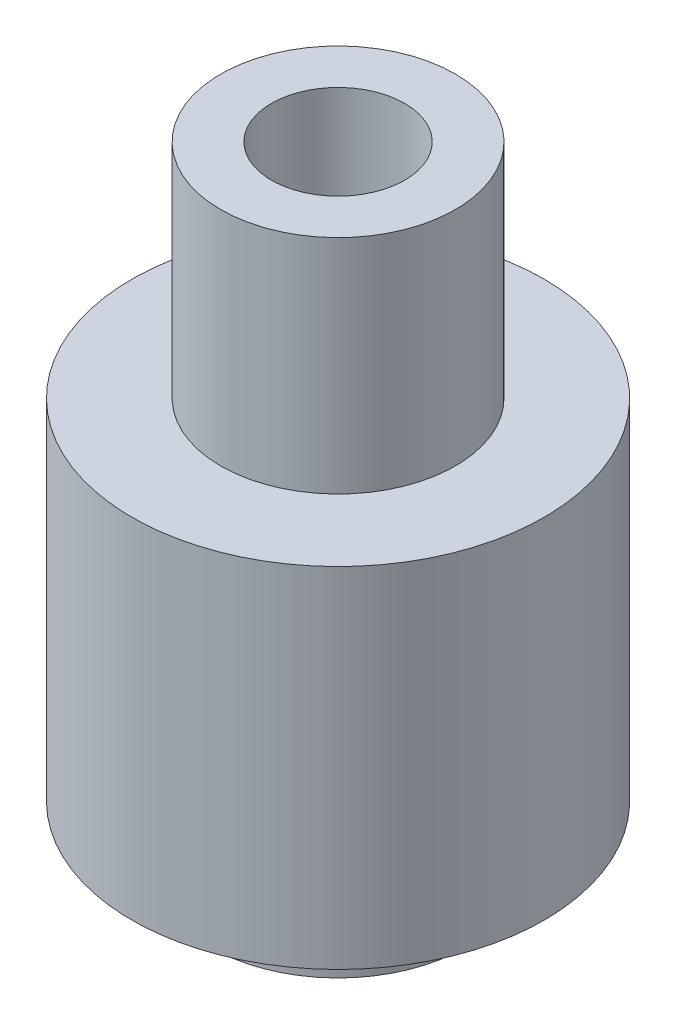
from build123d import *


with BuildPart() as part:
    # Reconstructed nominal axial profile → Native revolved geometry (revolve)
    with BuildSketch(Plane.XY, mode=Mode.PRIVATE) as native_revolved_geometry_sk:
        Polygon((2.1, -13), (2.1, 7), (3.7, 7), (3.7, 0), (6.5, 0), (6.5, -11), (4, -11), (4, -13), align=None)
    revolve(native_revolved_geometry_sk.sketch.rotate(Axis((0, -500, 0), (0, 1, 0)), 90), axis=Axis((0, -500, 0), (0, 1, 0)))


solid = part.part
